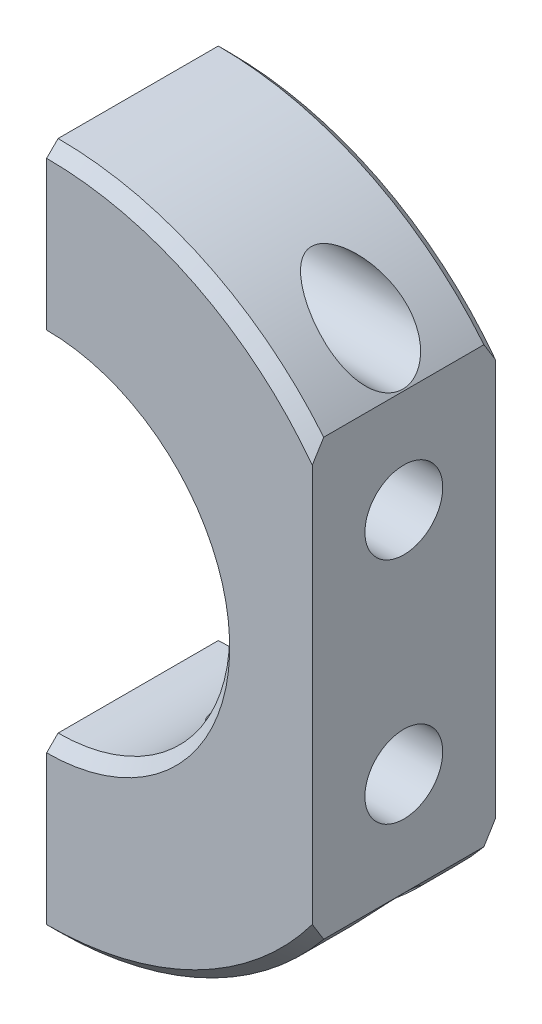
from build123d import *

# Parameters (mm, degrees)
EXTRUDE_1_DEPTH     = 8
SKETCH_2_R          = 1.7
CUT_EXTRUDE_2_DEPTH = 15
SKETCH_3_R          = 1.7
CUT_EXTRUDE_4_DEPTH = 15
CHAMFER_1_SIZE      = 0.5
SKETCH_4_R          = 1.7
CUT_EXTRUDE_5_DEPTH = 10


with BuildPart() as part:
    # 草图1 → 凸台-拉伸1 (new body)
    with BuildSketch(Plane.XY):
        with BuildLine():
            Line((-6.780789716, 23.005235362), (-6.780789716, 15.505235362))
            ThreePointArc((-6.780789716, 15.505235362), (0.719210284, 8.005235362), (-6.780789716, 0.505235362))
            Line((-6.780789716, 0.505235362), (-6.780789716, -6.994764638))
            ThreePointArc((-6.780789716, -6.994764638), (-0.358173427, -5.55020635), (4.82739705, -1.494764638))
            Line((4.82739705, -1.494764638), (4.82739705, 17.505235362))
            ThreePointArc((4.82739705, 17.505235362), (-0.358173427, 21.560677073), (-6.780789716, 23.005235362))
        make_face()
    extrude(amount=EXTRUDE_1_DEPTH)

    # 草图2 → 切除-拉伸2 (cut)
    with BuildSketch(Plane.ZY.offset(6.780789716)):
        with Locations((4, 19.255235362)):
            Circle(SKETCH_2_R)
    extrude(amount=-CUT_EXTRUDE_2_DEPTH, mode=Mode.SUBTRACT)

    # 草图3 → 切除-拉伸4 (cut)
    with BuildSketch(Plane.ZY.offset(6.780789716)):
        with Locations((4, -3.244764638)):
            Circle(SKETCH_3_R)
    extrude(amount=-CUT_EXTRUDE_4_DEPTH, mode=Mode.SUBTRACT)

    # 倒角1
    chamfer_1_edges = [part.edges().sort_by_distance(p)[0] for p in [
        (-0.358173427, -5.55020635, 8),
        (-0.358173427, 21.560677073, 8),
        (0.719210284, 8.005235362, 8),
        (-0.358173427, 21.560677073, 0),
        (-0.358173427, -5.55020635, 0),
        (0.719210284, 8.005235362, 0),
    ]]
    chamfer(chamfer_1_edges, length=CHAMFER_1_SIZE)

    # 草图4 → 切除-拉伸5 (cut)
    with BuildSketch(Plane(origin=(4.82739705, 0, 0), x_dir=(0, 0, -1), z_dir=(1, 0, 0))):
        with Locations((-4, 13.005235362)):
            Circle(SKETCH_4_R)
        with Locations((-4, 3.005235362)):
            Circle(SKETCH_4_R)
    extrude(amount=-CUT_EXTRUDE_5_DEPTH, mode=Mode.SUBTRACT)


solid = part.part
